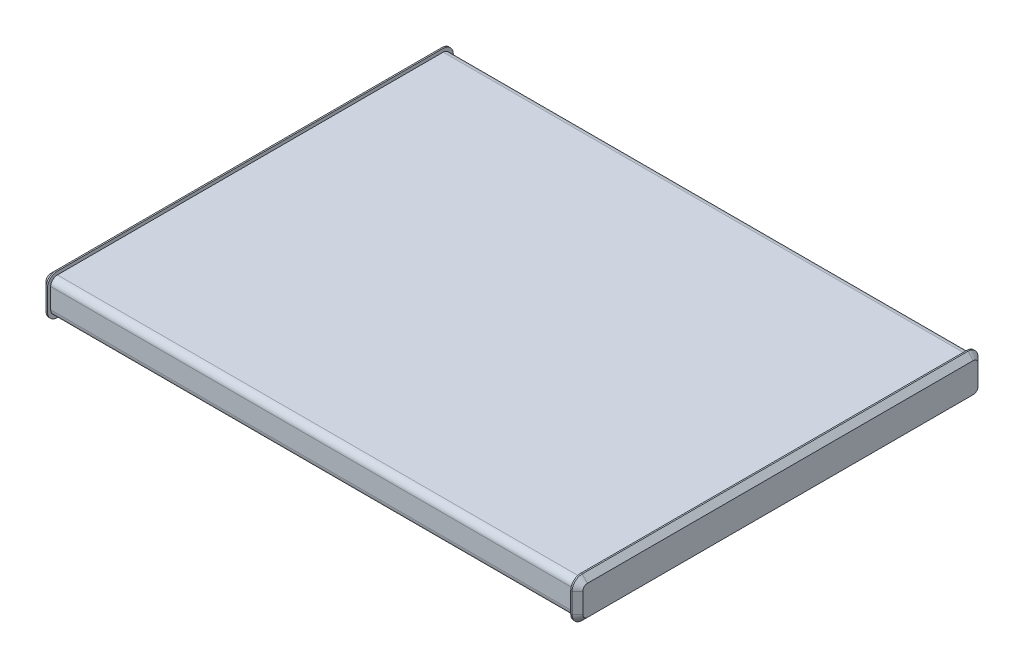
from build123d import *

# Parameters (mm, degrees)
SKETCH_1_W      = 80
SKETCH_1_H      = 59.5
EXTRUDE_1_DEPTH = 5
FILLET_1_R      = 1
EXTRUDE_2_DEPTH = 1
CHAMFER_1_SIZE  = 0.8
EXTRUDE_START   = -1
EXTRUDE_3_DEPTH = 1
CHAMFER_2_SIZE  = 0.8


with BuildPart() as part:
    # 草图1 → 凸台-拉伸1 (new body)
    with BuildSketch(Plane(origin=(0, 0, 0), x_dir=(1, 0, 0), z_dir=(0, 1, 0))):
        with Locations((59.287159713, -12.081031523)):
            Rectangle(SKETCH_1_W, SKETCH_1_H)
    extrude(amount=EXTRUDE_1_DEPTH)

    # 圆角1
    fillet_1_edges = [part.edges().sort_by_distance(p)[0] for p in [
        (59.287159713, 5, -17.668968477),
        (59.287159713, 0, -17.668968477),
        (59.287159713, 0, 41.831031523),
        (59.287159713, 5, 41.831031523),
    ]]
    fillet(fillet_1_edges, radius=FILLET_1_R)

    # 草图2 → 凸台-拉伸2 (add)
    with BuildSketch(Plane(origin=(99.287159713, 0, 0), x_dir=(0, 0, -1), z_dir=(1, 0, 0))):
        with BuildLine():
            Line((16.668968477, 5.5), (-40.831031523, 5.5))
            ThreePointArc((-40.831031523, 5.5), (-41.891691695, 5.060660172), (-42.331031523, 4))
            Line((-42.331031523, 4), (-42.331031523, 1))
            ThreePointArc((-42.331031523, 1), (-41.891691695, -0.060660172), (-40.831031523, -0.5))
            Line((-40.831031523, -0.5), (16.668968477, -0.5))
            ThreePointArc((16.668968477, -0.5), (17.729628648, -0.060660172), (18.168968477, 1))
            Line((18.168968477, 1), (18.168968477, 4))
            ThreePointArc((18.168968477, 4), (17.729628648, 5.060660172), (16.668968477, 5.5))
        make_face()
    extrude(amount=-EXTRUDE_2_DEPTH)

    # 倒角1
    chamfer_1_edges = [part.edges().sort_by_distance(p)[0] for p in [
        (99.287159713, 5.060660172, -17.729628648),
        (99.287159713, 5.5, 12.081031523),
        (99.287159713, 5.060660172, 41.891691695),
        (99.287159713, 2.5, 42.331031523),
        (99.287159713, -0.060660172, 41.891691695),
        (99.287159713, -0.5, 12.081031523),
        (99.287159713, -0.060660172, -17.729628648),
        (99.287159713, 2.5, -18.168968477),
    ]]
    chamfer(chamfer_1_edges, length=CHAMFER_1_SIZE)

    # 草图3 → 凸台-拉伸3 (add)
    with BuildSketch(Plane.ZY.offset(-19.287159713).offset(EXTRUDE_START)):
        with BuildLine():
            Line((40.831031523, 5.5), (-16.668968477, 5.5))
            ThreePointArc((-16.668968477, 5.5), (-17.729628648, 5.060660172), (-18.168968477, 4))
            Line((-18.168968477, 4), (-18.168968477, 1))
            ThreePointArc((-18.168968477, 1), (-17.729628648, -0.060660172), (-16.668968477, -0.5))
            Line((-16.668968477, -0.5), (40.831031523, -0.5))
            ThreePointArc((40.831031523, -0.5), (41.891691695, -0.060660172), (42.331031523, 1))
            Line((42.331031523, 1), (42.331031523, 4))
            ThreePointArc((42.331031523, 4), (41.891691695, 5.060660172), (40.831031523, 5.5))
        make_face()
    extrude(amount=EXTRUDE_3_DEPTH)

    # 倒角2
    chamfer_2_edges = [part.edges().sort_by_distance(p)[0] for p in [
        (19.287159713, 5.060660172, 41.891691695),
        (19.287159713, 5.5, 12.081031523),
        (19.287159713, 5.060660172, -17.729628648),
        (19.287159713, 2.5, -18.168968477),
        (19.287159713, -0.060660172, -17.729628648),
        (19.287159713, -0.5, 12.081031523),
        (19.287159713, -0.060660172, 41.891691695),
        (19.287159713, 2.5, 42.331031523),
    ]]
    chamfer(chamfer_2_edges, length=CHAMFER_2_SIZE)


solid = part.part
